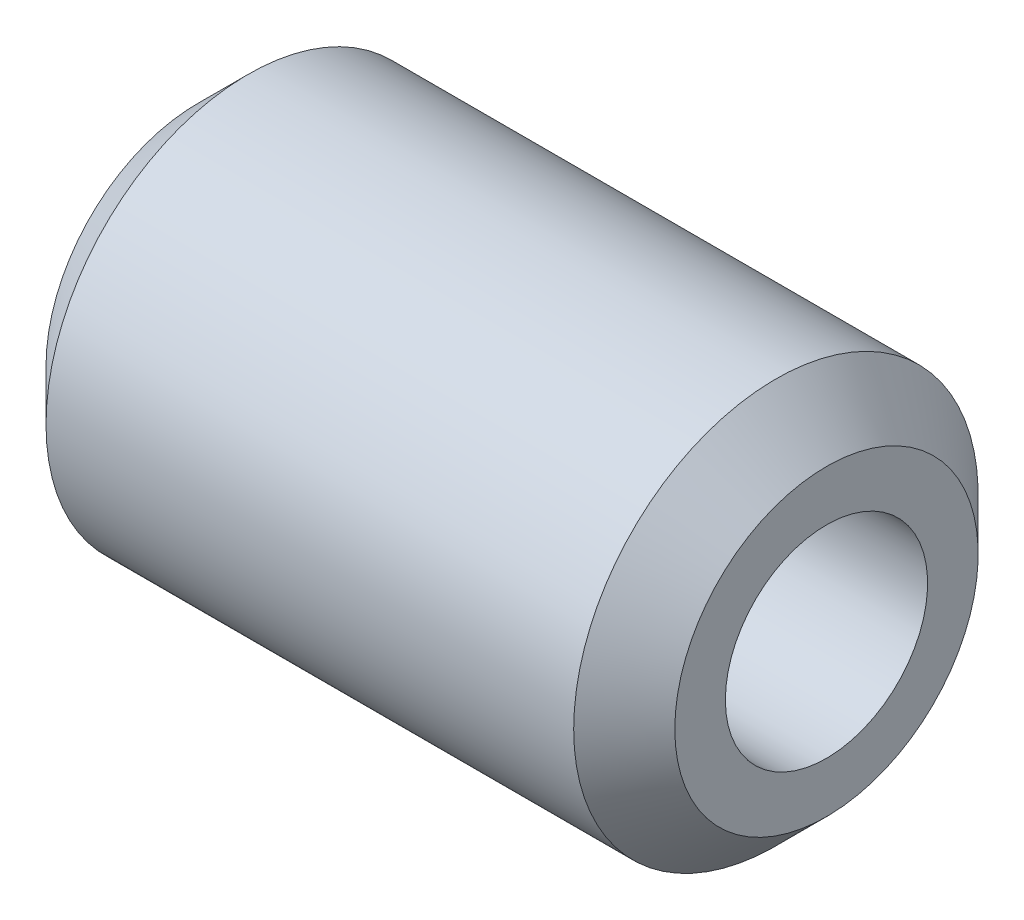
from build123d import *


with BuildPart() as part:
    # Sketch1 → Revolve1 (revolve)
    with BuildSketch(Plane.XY, mode=Mode.PRIVATE) as revolve1_sk:
        Polygon((-17.1, 5.5), (-17.1, 8.25), (-14.35, 11), (14.35, 11), (17.1, 8.25), (17.1, 5.5), align=None)
    revolve(revolve1_sk.sketch.rotate(Axis((-73.003968473, 0, 0), (1, 0, 0)), 90), axis=Axis((-73.003968473, 0, 0), (1, 0, 0)))


solid = part.part
